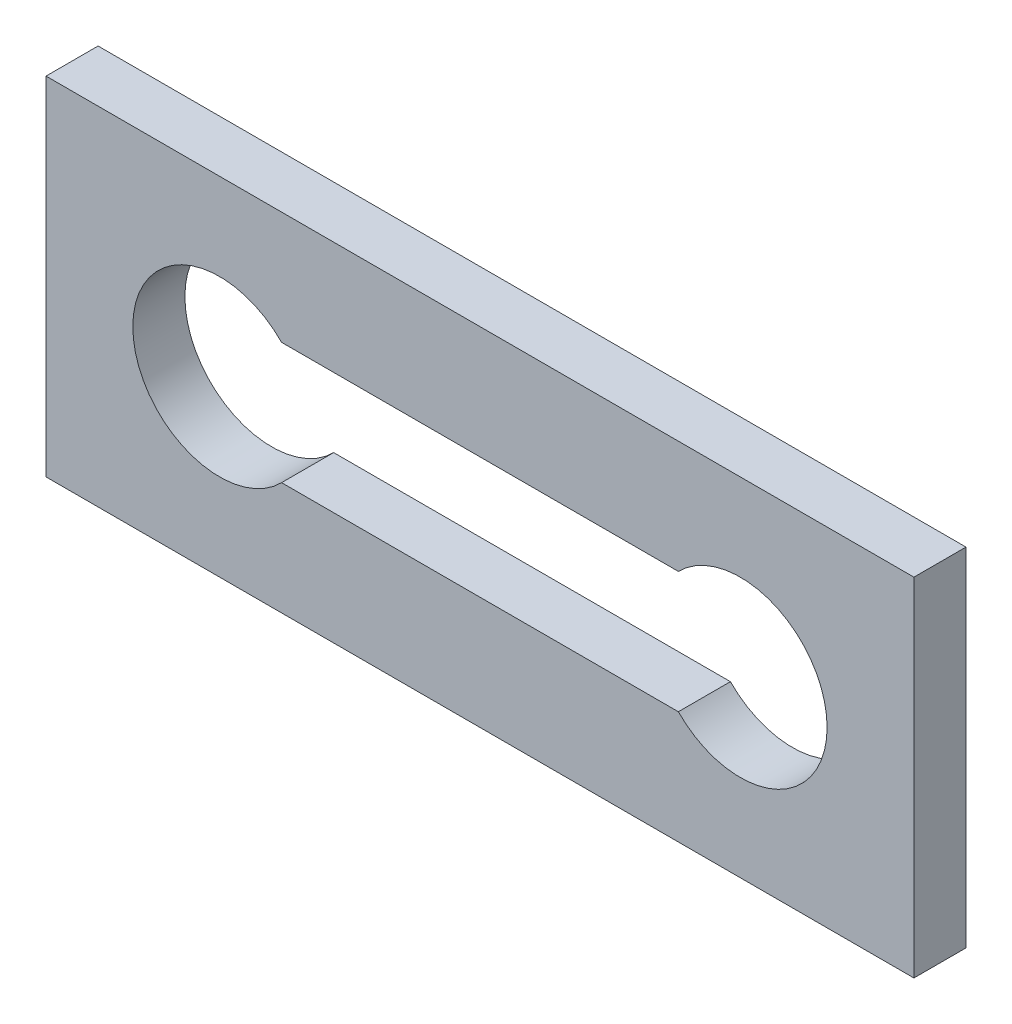
from build123d import *

# Parameters (mm, degrees)
SKETCH_1_W          = 50
SKETCH_1_H          = 20
EXTRUDE_1_DEPTH     = 3
SKETCH_2_R          = 5
SKETCH_2_W          = 30
SKETCH_2_H          = 7
CUT_EXTRUDE_1_DEPTH = 3


with BuildPart() as part:
    # 스케치1 → 보스-돌출1 (new body)
    with BuildSketch(Plane.XY):
        Rectangle(SKETCH_1_W, SKETCH_1_H)
    extrude(amount=EXTRUDE_1_DEPTH)

    # 스케치2 → 컷-돌출1 (cut)
    with BuildSketch(Plane.XY.offset(3)):
        with Locations((-15, 0)):
            Circle(SKETCH_2_R)
        with Locations((15, 0)):
            Circle(SKETCH_2_R)
        Rectangle(SKETCH_2_W, SKETCH_2_H)
    extrude(amount=-CUT_EXTRUDE_1_DEPTH, mode=Mode.SUBTRACT)


solid = part.part
